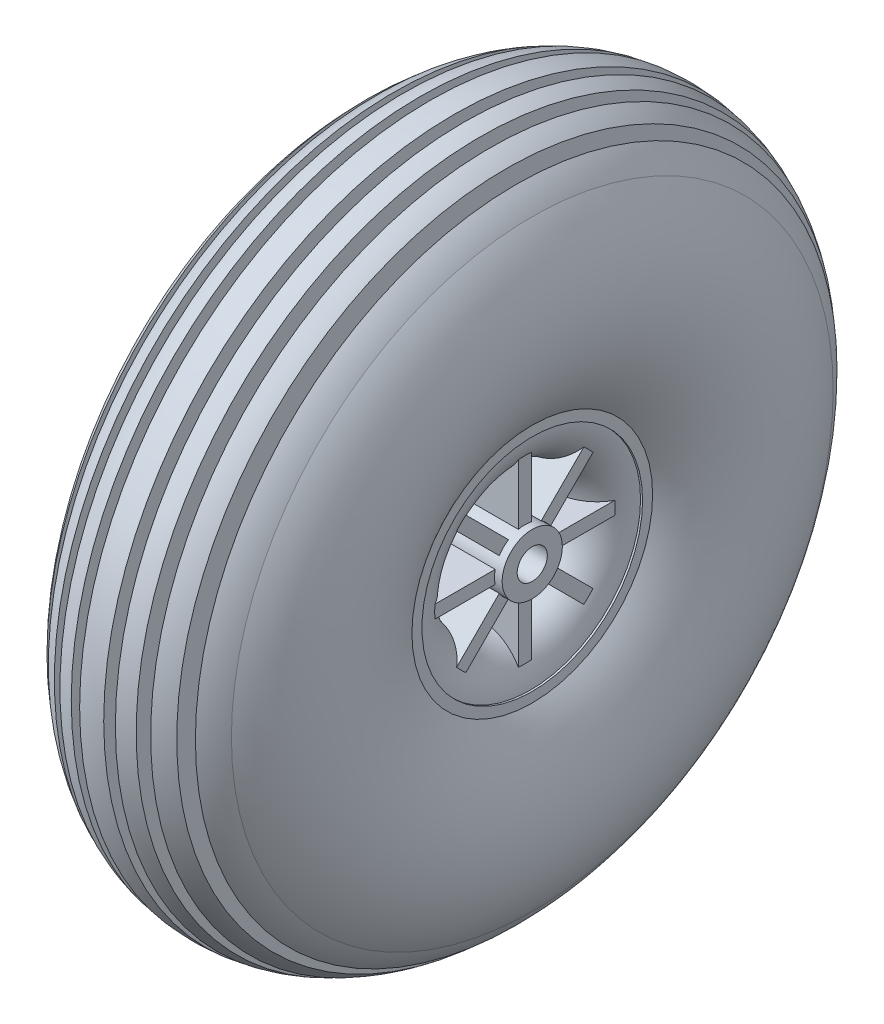
from build123d import *

# Parameters (mm, degrees)
SKETCH1_4_W         = 22.86
SKETCH1_4_H         = 1.905
SKETCH1_5_W         = 1.27
SKETCH1_5_H         = 4.699
BOSS_EXTRUDE1_DEPTH = 9.8552
BOSS_EXTRUDE2_START = -11.1252
BOSS_EXTRUDE2_DEPTH = 11.1252


with BuildPart() as part:
    # Sketch1 → Revolve1 (revolve)
    with BuildSketch(Plane.XY):
        with BuildLine():
            ThreePointArc((-11.43, 38.1), (-15.24, 26.67), (-11.43, 15.24))
            Line((-11.43, 15.24), (11.43, 15.24))
            ThreePointArc((11.43, 15.24), (15.24, 26.67), (11.43, 38.1))
            ThreePointArc((11.43, 38.1), (10.490345613, 39.424711026), (9.398, 40.626622308))
            Line((9.398, 40.626622308), (9.398, 38.1))
            Line((9.398, 38.1), (8.128, 38.1))
            Line((8.128, 38.1), (8.128, 41.719312129))
            ThreePointArc((8.128, 41.719312129), (7.140352613, 42.400309519), (6.096, 42.990675868))
            Line((6.096, 42.990675868), (6.096, 39.986982904))
            Line((6.096, 39.986982904), (4.826, 39.986982904))
            Line((4.826, 39.986982904), (4.826, 43.555225947))
            ThreePointArc((4.826, 43.555225947), (3.821857195, 43.896092484), (2.794, 44.156865099))
            Line((2.794, 44.156865099), (2.794, 41.652293483))
            Line((2.794, 41.652293483), (1.524, 41.652293483))
            Line((1.524, 41.652293483), (1.524, 44.363457674))
            ThreePointArc((1.524, 44.363457674), (0, 44.45), (-1.524, 44.363457674))
            Line((-1.524, 44.363457674), (-1.524, 41.652293483))
            Line((-1.524, 41.652293483), (-2.794, 41.652293483))
            Line((-2.794, 41.652293483), (-2.794, 44.156865099))
            ThreePointArc((-2.794, 44.156865099), (-3.821857195, 43.896092484), (-4.826, 43.555225947))
            Line((-4.826, 43.555225947), (-4.826, 39.986982904))
            Line((-4.826, 39.986982904), (-6.096, 39.986982904))
            Line((-6.096, 39.986982904), (-6.096, 42.990675868))
            ThreePointArc((-6.096, 42.990675868), (-7.140352613, 42.400309519), (-8.128, 41.719312129))
            Line((-8.128, 41.719312129), (-8.128, 38.1))
            Line((-8.128, 38.1), (-9.398, 38.1))
            Line((-9.398, 38.1), (-9.398, 40.626622308))
            ThreePointArc((-9.398, 40.626622308), (-10.490345613, 39.424711026), (-11.43, 38.1))
        make_face()
    revolve(axis=Axis((0, 0, 0), (-1, 0, 0)))

    # Sketch1<3> → Revolve2 (revolve)
    with BuildSketch(Plane.XY):
        with BuildLine():
            Line((11.43, 15.24), (-11.43, 15.24))
            Line((-11.43, 15.24), (-11.43, 13.97))
            Line((-11.43, 13.97), (-11.176, 13.97))
            ThreePointArc((-11.176, 13.97), (-9.495138364, 10.100996871), (-5.588729909, 8.509))
            Line((-5.588729909, 8.509), (-0.635, 8.509))
            Line((-0.635, 8.509), (0.635, 8.509))
            Line((0.635, 8.509), (5.588729909, 8.509))
            ThreePointArc((5.588729909, 8.509), (9.495138364, 10.100996871), (11.176, 13.97))
            Line((11.176, 13.97), (11.43, 13.97))
            Line((11.43, 13.97), (11.43, 15.24))
        make_face()
    revolve(axis=Axis((0, 0, 0), (-1, 0, 0)))



with BuildPart() as body_2:
    # Sketch1<4> → Revolve3 (revolve)
    with BuildSketch(Plane.XY):
        with Locations((0, 2.8575)):
            Rectangle(SKETCH1_4_W, SKETCH1_4_H)
    revolve(axis=Axis((0, 0, 0), (-1, 0, 0)))


with BuildPart() as part_1:
    add(part.part)

    add(body_2.part)  # Revolve5 merges body 2
    # Sketch1<5> → Revolve5 (revolve)
    with BuildSketch(Plane.XY):
        with Locations((0, 6.1595)):
            Rectangle(SKETCH1_5_W, SKETCH1_5_H)
    revolve(axis=Axis((0, 0, 0), (-1, 0, 0)))

    # Sketch4 → Boss-Extrude1 (add)
    with BuildSketch(Plane(origin=(0.635, 0, 0), x_dir=(0, 0, -1), z_dir=(1, 0, 0))):
        with BuildLine():
            Line((-0.8255, 11.400151304), (-0.8255, 3.750471157))
            ThreePointArc((-0.8255, 3.750471157), (0, 3.840245324), (0.8255, 3.750471157))
            Line((0.8255, 3.750471157), (0.8255, 11.400151304))
            ThreePointArc((0.8255, 11.400151304), (0, 11.43), (-0.8255, 11.400151304))
        make_face()
        with BuildLine():
            Line((7.477407646, 8.644840941), (2.06826694, 3.235700235))
            ThreePointArc((2.06826694, 3.235700235), (2.71546351, 2.71546351), (3.235700235, 2.06826694))
            Line((3.235700235, 2.06826694), (8.644840941, 7.477407646))
            ThreePointArc((8.644840941, 7.477407646), (8.082230509, 8.082230509), (7.477407646, 8.644840941))
        make_face()
        with BuildLine():
            Line((11.400151304, 0.8255), (3.750471157, 0.8255))
            ThreePointArc((3.750471157, 0.8255), (3.840245324, 0), (3.750471157, -0.8255))
            Line((3.750471157, -0.8255), (11.400151304, -0.8255))
            ThreePointArc((11.400151304, -0.8255), (11.43, 0), (11.400151304, 0.8255))
        make_face()
        with BuildLine():
            Line((8.644840941, -7.477407646), (3.235700235, -2.06826694))
            ThreePointArc((3.235700235, -2.06826694), (2.71546351, -2.71546351), (2.06826694, -3.235700235))
            Line((2.06826694, -3.235700235), (7.477407646, -8.644840941))
            ThreePointArc((7.477407646, -8.644840941), (8.082230509, -8.082230509), (8.644840941, -7.477407646))
        make_face()
        with BuildLine():
            Line((0.8255, -11.400151304), (0.8255, -3.750471157))
            ThreePointArc((0.8255, -3.750471157), (0, -3.840245324), (-0.8255, -3.750471157))
            Line((-0.8255, -3.750471157), (-0.8255, -11.400151304))
            ThreePointArc((-0.8255, -11.400151304), (0, -11.43), (0.8255, -11.400151304))
        make_face()
        with BuildLine():
            Line((-7.477407646, -8.644840941), (-2.06826694, -3.235700235))
            ThreePointArc((-2.06826694, -3.235700235), (-2.71546351, -2.71546351), (-3.235700235, -2.06826694))
            Line((-3.235700235, -2.06826694), (-8.644840941, -7.477407646))
            ThreePointArc((-8.644840941, -7.477407646), (-8.082230509, -8.082230509), (-7.477407646, -8.644840941))
        make_face()
        with BuildLine():
            Line((-11.400151304, -0.8255), (-3.750471157, -0.8255))
            ThreePointArc((-3.750471157, -0.8255), (-3.840245324, 0), (-3.750471157, 0.8255))
            Line((-3.750471157, 0.8255), (-11.400151304, 0.8255))
            ThreePointArc((-11.400151304, 0.8255), (-11.43, 0), (-11.400151304, -0.8255))
        make_face()
        with BuildLine():
            Line((-8.644840941, 7.477407646), (-3.235700235, 2.06826694))
            ThreePointArc((-3.235700235, 2.06826694), (-2.71546351, 2.71546351), (-2.06826694, 3.235700235))
            Line((-2.06826694, 3.235700235), (-7.477407646, 8.644840941))
            ThreePointArc((-7.477407646, 8.644840941), (-8.082230509, 8.082230509), (-8.644840941, 7.477407646))
        make_face()
    extrude(amount=BOSS_EXTRUDE1_DEPTH)

    # Sketch4<2> → Boss-Extrude2 (add)
    with BuildSketch(Plane(origin=(0.635, 0, 0), x_dir=(0, 0, -1), z_dir=(1, 0, 0)).offset(BOSS_EXTRUDE2_START)):
        with BuildLine():
            Line((-0.8255, 11.400151304), (-0.8255, 3.750471157))
            ThreePointArc((-0.8255, 3.750471157), (0, 3.840245324), (0.8255, 3.750471157))
            Line((0.8255, 3.750471157), (0.8255, 11.400151304))
            ThreePointArc((0.8255, 11.400151304), (0, 11.43), (-0.8255, 11.400151304))
        make_face()
        with BuildLine():
            Line((7.477407646, 8.644840941), (2.06826694, 3.235700235))
            ThreePointArc((2.06826694, 3.235700235), (2.71546351, 2.71546351), (3.235700235, 2.06826694))
            Line((3.235700235, 2.06826694), (8.644840941, 7.477407646))
            ThreePointArc((8.644840941, 7.477407646), (8.082230509, 8.082230509), (7.477407646, 8.644840941))
        make_face()
        with BuildLine():
            Line((11.400151304, 0.8255), (3.750471157, 0.8255))
            ThreePointArc((3.750471157, 0.8255), (3.840245324, 0), (3.750471157, -0.8255))
            Line((3.750471157, -0.8255), (11.400151304, -0.8255))
            ThreePointArc((11.400151304, -0.8255), (11.43, 0), (11.400151304, 0.8255))
        make_face()
        with BuildLine():
            Line((8.644840941, -7.477407646), (3.235700235, -2.06826694))
            ThreePointArc((3.235700235, -2.06826694), (2.71546351, -2.71546351), (2.06826694, -3.235700235))
            Line((2.06826694, -3.235700235), (7.477407646, -8.644840941))
            ThreePointArc((7.477407646, -8.644840941), (8.082230509, -8.082230509), (8.644840941, -7.477407646))
        make_face()
        with BuildLine():
            Line((0.8255, -11.400151304), (0.8255, -3.750471157))
            ThreePointArc((0.8255, -3.750471157), (0, -3.840245324), (-0.8255, -3.750471157))
            Line((-0.8255, -3.750471157), (-0.8255, -11.400151304))
            ThreePointArc((-0.8255, -11.400151304), (0, -11.43), (0.8255, -11.400151304))
        make_face()
        with BuildLine():
            Line((-7.477407646, -8.644840941), (-2.06826694, -3.235700235))
            ThreePointArc((-2.06826694, -3.235700235), (-2.71546351, -2.71546351), (-3.235700235, -2.06826694))
            Line((-3.235700235, -2.06826694), (-8.644840941, -7.477407646))
            ThreePointArc((-8.644840941, -7.477407646), (-8.082230509, -8.082230509), (-7.477407646, -8.644840941))
        make_face()
        with BuildLine():
            Line((-11.400151304, -0.8255), (-3.750471157, -0.8255))
            ThreePointArc((-3.750471157, -0.8255), (-3.840245324, 0), (-3.750471157, 0.8255))
            Line((-3.750471157, 0.8255), (-11.400151304, 0.8255))
            ThreePointArc((-11.400151304, 0.8255), (-11.43, 0), (-11.400151304, -0.8255))
        make_face()
        with BuildLine():
            Line((-8.644840941, 7.477407646), (-3.235700235, 2.06826694))
            ThreePointArc((-3.235700235, 2.06826694), (-2.71546351, 2.71546351), (-2.06826694, 3.235700235))
            Line((-2.06826694, 3.235700235), (-7.477407646, 8.644840941))
            ThreePointArc((-7.477407646, 8.644840941), (-8.082230509, 8.082230509), (-8.644840941, 7.477407646))
        make_face()
    extrude(amount=BOSS_EXTRUDE2_DEPTH)


solid = part_1.part
